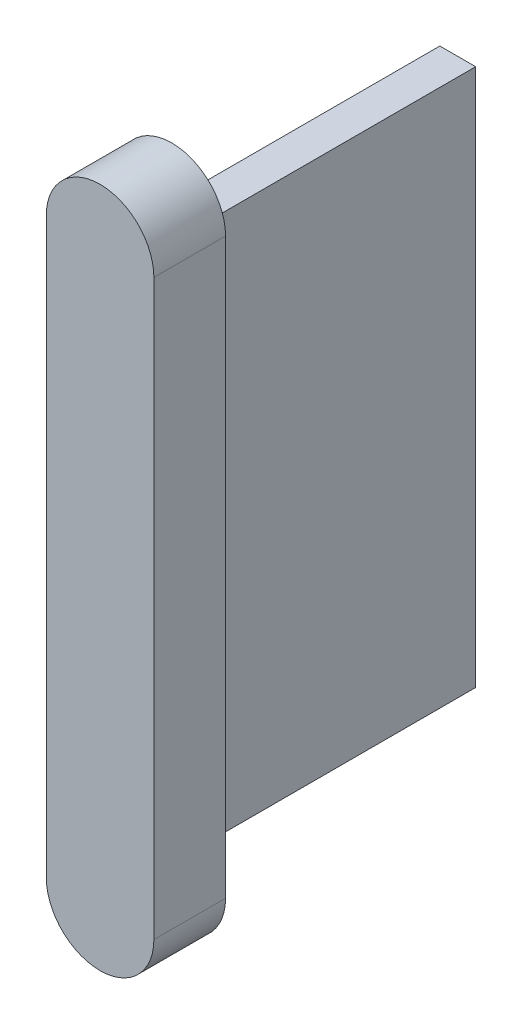
from build123d import *

# Parameters (mm, degrees)
EXTRUDE_1_DEPTH = 2
SKETCH_2_W      = 1
SKETCH_2_H      = 15
EXTRUDE_2_DEPTH = 8


with BuildPart() as part:
    # 草图1 → 凸台-拉伸1 (new body)
    with BuildSketch(Plane.XY):
        with BuildLine():
            Line((1.5, -13.673349455), (1.5, -29.673349455))
            ThreePointArc((1.5, -29.673349455), (0, -31.173349455), (-1.5, -29.673349455))
            Line((-1.5, -29.673349455), (-1.5, -13.673349455))
            ThreePointArc((-1.5, -13.673349455), (0, -12.173349455), (1.5, -13.673349455))
        make_face()
    extrude(amount=EXTRUDE_1_DEPTH)

    # 草图2 → 凸台-拉伸2 (add)
    with BuildSketch(Plane(origin=(0, 0, 0), x_dir=(-1, 0, 0), z_dir=(0, 0, -1))):
        with Locations((0.022272941, -21.592941234)):
            Rectangle(SKETCH_2_W, SKETCH_2_H)
    extrude(amount=EXTRUDE_2_DEPTH)


solid = part.part
